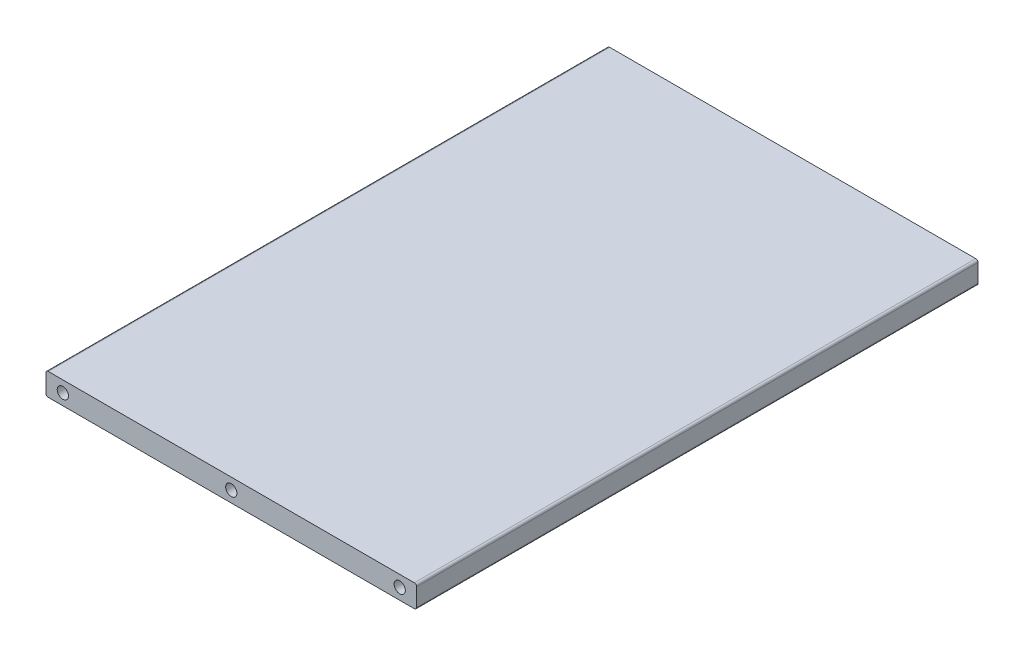
from build123d import *

# Parameters (mm, degrees)
SKETCH1_W           = 330
SKETCH1_H           = 500
BOSS_EXTRUDE1_DEPTH = 20
SKETCH2_R           = 5
CUT_EXTRUDE1_DEPTH  = 527.901319034
FILLET1_R           = 2


with BuildPart() as part:
    # Sketch1 → Boss-Extrude1 (new body)
    with BuildSketch(Plane(origin=(0, 0, 0), x_dir=(1, 0, 0), z_dir=(0, 1, 0))):
        Rectangle(SKETCH1_W, SKETCH1_H)
    extrude(amount=BOSS_EXTRUDE1_DEPTH)

    # Sketch2 → Cut-Extrude1 (cut, through all)
    with BuildSketch(Plane.XY.offset(250)):
        with Locations((0, 10)):
            Circle(SKETCH2_R)
        with Locations((-150, 10)):
            Circle(SKETCH2_R)
        with Locations((150, 10)):
            Circle(SKETCH2_R)
    extrude(amount=-CUT_EXTRUDE1_DEPTH, mode=Mode.SUBTRACT)

    # Fillet1
    fillet1_edges = [part.edges().sort_by_distance(p)[0] for p in [
        (-165, 20, 0),
        (165, 20, 0),
        (-165, 0, 0),
        (165, 0, 0),
    ]]
    fillet(fillet1_edges, radius=FILLET1_R)


solid = part.part
